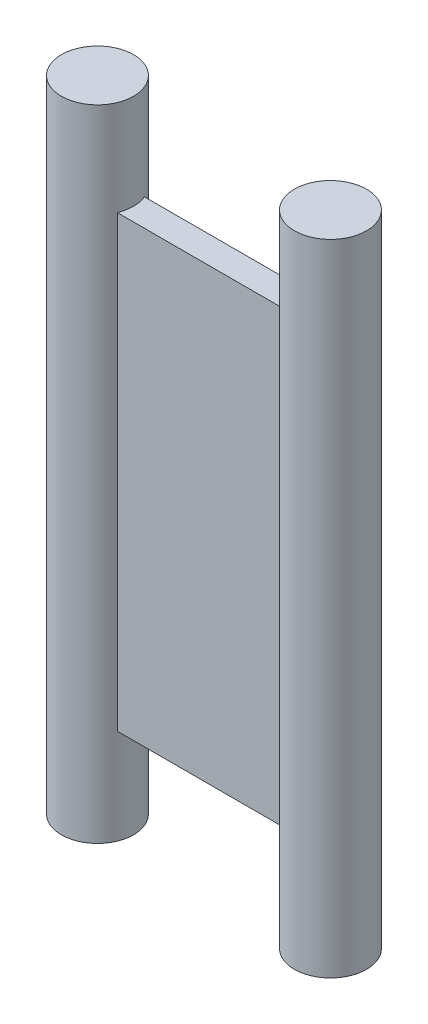
from build123d import *

# Parameters (mm, degrees)
SKETCH1_W           = 8.56
SKETCH1_H           = 1
BOSS_EXTRUDE1_DEPTH = 16.5
SKETCH2_R           = 1.325
BOSS_EXTRUDE2_DEPTH = 11.75


with BuildPart() as part:
    # Sketch1 → Boss-Extrude1 (new body)
    with BuildSketch(Plane(origin=(0, 0, 0), x_dir=(1, 0, 0), z_dir=(0, 1, 0))):
        Rectangle(SKETCH1_W, SKETCH1_H)
    extrude(amount=BOSS_EXTRUDE1_DEPTH)

    # Sketch2 → Boss-Extrude2 (add, symmetric)
    with BuildSketch(Plane(origin=(0, 8.25, 0), x_dir=(1, 0, 0), z_dir=(0, 1, 0))):
        with Locations(Location((-4.28, 0, 0), (0, 0, 270))):
            Circle(SKETCH2_R)
        with Locations(Location((4.28, 0, 0), (0, 0, 270))):
            Circle(SKETCH2_R)
    extrude(amount=BOSS_EXTRUDE2_DEPTH, both=True)


solid = part.part
